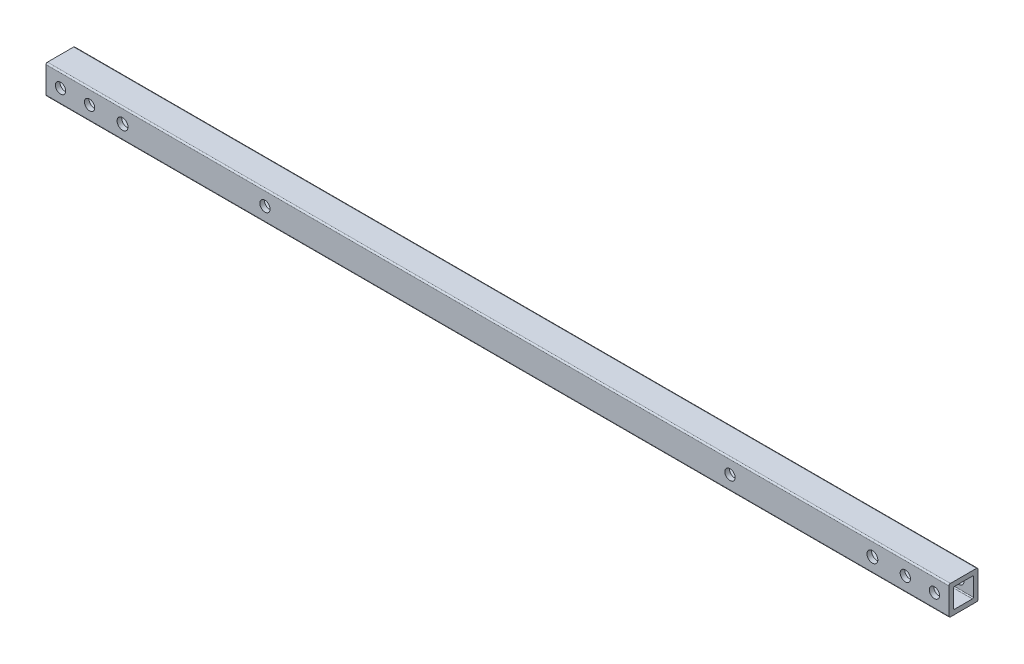
from build123d import *

# Parameters (mm, degrees)
BOSS_EXTRUDE1_DEPTH              = 295.91
F_1_4_CLEARANCE_HOLE1_AT_2_COUNT = 2
F_1_4_CLEARANCE_HOLE1_AT_2_PITCH = 31.75
F_1_4_CLEARANCE_HOLE1_AT_3_COUNT = 2
F_1_4_CLEARANCE_HOLE1_AT_3_PITCH = 50.8
F_1_4_CLEARANCE_HOLE1_AT_4_COUNT = 2
F_1_4_CLEARANCE_HOLE1_AT_4_PITCH = 165.735
F_1_4_CLEARANCE_HOLE2_D          = 7.14248


with BuildPart() as part:
    # Sketch4 → Boss-Extrude1 (new, symmetric)
    with BuildSketch(Plane(origin=(0, 0, 0), x_dir=(0, 0, -1), z_dir=(1, 0, 0))):
        with BuildLine():
            Line((9.525, -8.5725), (9.525, 8.5725))
            ThreePointArc((9.525, 8.5725), (9.246019209, 9.246019209), (8.5725, 9.525))
            Line((8.5725, 9.525), (-8.5725, 9.525))
            ThreePointArc((-8.5725, 9.525), (-9.246019209, 9.246019209), (-9.525, 8.5725))
            Line((-9.525, 8.5725), (-9.525, -8.5725))
            ThreePointArc((-9.525, -8.5725), (-9.246019209, -9.246019209), (-8.5725, -9.525))
            Line((-8.5725, -9.525), (8.5725, -9.525))
            ThreePointArc((8.5725, -9.525), (9.246019209, -9.246019209), (9.525, -8.5725))
        make_face()
        with BuildLine():
            Line((6.477, 5.8293), (6.477, -5.8293))
            ThreePointArc((6.477, -5.8293), (6.287293062, -6.287293062), (5.8293, -6.477))
            Line((5.8293, -6.477), (-5.8293, -6.477))
            ThreePointArc((-5.8293, -6.477), (-6.287293062, -6.287293062), (-6.477, -5.8293))
            Line((-6.477, -5.8293), (-6.477, 5.8293))
            ThreePointArc((-6.477, 5.8293), (-6.287293062, 6.287293062), (-5.8293, 6.477))
            Line((-5.8293, 6.477), (5.8293, 6.477))
            ThreePointArc((5.8293, 6.477), (6.287293062, 6.287293062), (6.477, 5.8293))
        make_face(mode=Mode.SUBTRACT)
    extrude(amount=BOSS_EXTRUDE1_DEPTH, both=True)

    # Sketch6 → 1/4 Clearance Hole1 (revolve, cut)
    with BuildSketch(Plane(origin=(318.135, 0, -9.525), x_dir=(0, 1, 0), z_dir=(1, 0, 0))):
        Polygon((0, 0), (0, 21.079827343), (3.3782, 19.05), (3.3782, 0), align=None)
    f_1_4_clearance_hole1 = revolve(axis=Axis((318.135, 0, -15.875), (0, 0, 1)), mode=Mode.SUBTRACT)

    # 1/4 Clearance Hole1 at 2: 1/4 Clearance Hole1 ×2
    with Locations(*[(-i * F_1_4_CLEARANCE_HOLE1_AT_2_PITCH, 0, 0) for i in range(1, F_1_4_CLEARANCE_HOLE1_AT_2_COUNT)]):
        add(f_1_4_clearance_hole1, mode=Mode.SUBTRACT)

    # 1/4 Clearance Hole1 at 3: 1/4 Clearance Hole1 ×2
    with Locations(*[(-i * F_1_4_CLEARANCE_HOLE1_AT_3_PITCH, 0, 0) for i in range(1, F_1_4_CLEARANCE_HOLE1_AT_3_COUNT)]):
        add(f_1_4_clearance_hole1, mode=Mode.SUBTRACT)

    # 1/4 Clearance Hole1 at 4: 1/4 Clearance Hole1 ×2
    with Locations(*[(-i * F_1_4_CLEARANCE_HOLE1_AT_4_PITCH, 0, 0) for i in range(1, F_1_4_CLEARANCE_HOLE1_AT_4_COUNT)]):
        add(f_1_4_clearance_hole1, mode=Mode.SUBTRACT)

    # Mirror2: 1/4 Clearance Hole1 across plane
    add(f_1_4_clearance_hole1.mirror(Plane(origin=(0, 0, 0), x_dir=(0, 0, 1), z_dir=(1, 0, 0))), mode=Mode.SUBTRACT)

    # Mirror2 copy 1 sketch → Mirror2 copy 1 (revolve, cut)
    with BuildSketch(Plane(origin=(-286.385, 0, -9.525), x_dir=(0, 1, 0), z_dir=(-1, 0, 0))):
        Polygon((0, 0), (0, -21.079827343), (3.3782, -19.05), (3.3782, 0), align=None)
    revolve(axis=Axis((-286.385, 0, -15.875), (0, 0, -1)), mode=Mode.SUBTRACT)

    # Mirror2 copy 2 sketch → Mirror2 copy 2 (revolve, cut)
    with BuildSketch(Plane(origin=(-267.335, 0, -9.525), x_dir=(0, 1, 0), z_dir=(-1, 0, 0))):
        Polygon((0, 0), (0, -21.079827343), (3.3782, -19.05), (3.3782, 0), align=None)
    revolve(axis=Axis((-267.335, 0, -15.875), (0, 0, -1)), mode=Mode.SUBTRACT)

    # Mirror2 copy 3 sketch → Mirror2 copy 3 (revolve, cut)
    with BuildSketch(Plane(origin=(-152.4, 0, -9.525), x_dir=(0, 1, 0), z_dir=(-1, 0, 0))):
        Polygon((0, 0), (0, -21.079827343), (3.3782, -19.05), (3.3782, 0), align=None)
    revolve(axis=Axis((-152.4, 0, -15.875), (0, 0, -1)), mode=Mode.SUBTRACT)

    # 1/4 Clearance Hole2 (through all)
    with Locations(Plane.XY.offset(9.525)):
        with Locations((245.745, 0), (-245.745, 0)):
            Hole(F_1_4_CLEARANCE_HOLE2_D / 2)


solid = part.part
